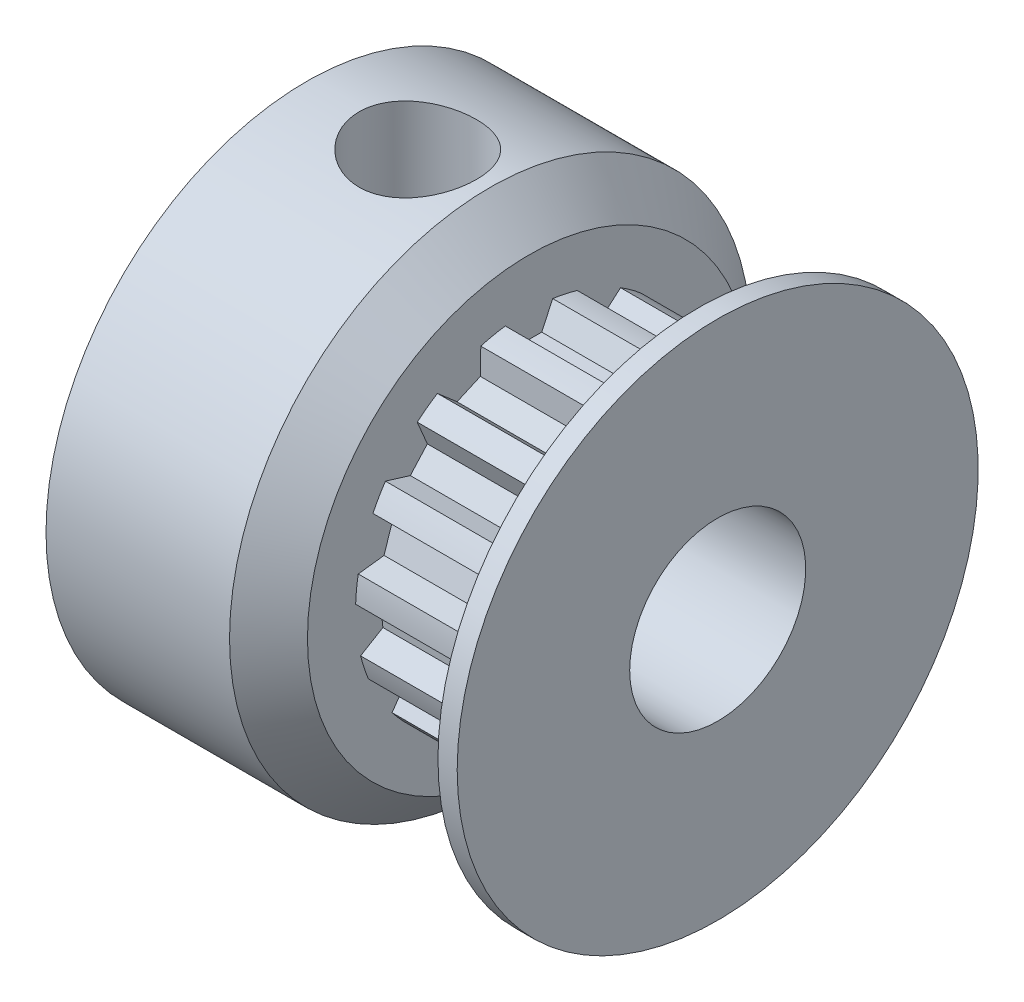
from build123d import *

# Parameters (mm, degrees)
SKETCH4_R          = 4.8514
SKETCH4_R_2        = 4.69265
CUT_EXTRUDE2_DEPTH = 4.064
CUT_EXTRUDE1_DEPTH = 4.064
CIRPATTERN1_COUNT  = 15
SKETCH6_R          = 1.5875
CUT_EXTRUDE3_DEPTH = 12.415131329


with BuildPart() as part:
    # Sketch1 → Revolve1 (revolve)
    with BuildSketch(Plane.XY, mode=Mode.PRIVATE) as revolve1_sk:
        with BuildLine():
            Line((-5.5626, 2.38125), (5.5626, 2.38125))
            Line((5.5626, 2.38125), (5.5626, 7.0485))
            Line((5.5626, 7.0485), (5.0419, 7.0485))
            ThreePointArc((5.0419, 7.0485), (4.654552953, 6.276378742), (4.5212, 5.4229))
            Line((4.5212, 5.4229), (4.5212, 4.8514))
            Line((4.5212, 4.8514), (0.4572, 4.8514))
            Line((0.4572, 4.8514), (0.4572, 5.9944))
            Line((0.4572, 5.9944), (-0.5969, 7.0485))
            Line((-0.5969, 7.0485), (-5.5626, 7.0485))
            Line((-5.5626, 7.0485), (-5.5626, 2.38125))
        make_face()
    revolve(revolve1_sk.sketch.rotate(Axis((-5.5626, 0, 0), (1, 0, 0)), 90), axis=Axis((-5.5626, 0, 0), (1, 0, 0)))

    # Sketch4 → Cut-Extrude2 (cut)
    with BuildSketch(Plane(origin=(0.4572, 0, 0), x_dir=(0, 0, -1), z_dir=(1, 0, 0))):
        Circle(SKETCH4_R)
        Circle(SKETCH4_R_2, mode=Mode.SUBTRACT)
    extrude(amount=CUT_EXTRUDE2_DEPTH, mode=Mode.SUBTRACT)

    # Sketch3 → Cut-Extrude1 (cut)
    with BuildSketch(Plane(origin=(0.4572, 0, 0), x_dir=(0, 0, -1), z_dir=(1, 0, 0))):
        with BuildLine():
            Line((-0.641825655, 4.648550726), (-0.344589457, 4.011125642))
            Line((-0.344589457, 4.011125642), (0.344589457, 4.011125642))
            Line((0.344589457, 4.011125642), (0.641825655, 4.648550726))
            ThreePointArc((0.641825655, 4.648550726), (0, 4.69265), (-0.641825655, 4.648550726))
        make_face()
    cut_extrude1 = extrude(amount=CUT_EXTRUDE1_DEPTH, mode=Mode.SUBTRACT)

    # CirPattern1: Cut-Extrude1 ×15 about axis
    cirpattern1_axis = Axis((0, 0, 0), (1, 0, 0))
    for i in range(1, CIRPATTERN1_COUNT):
        add(cut_extrude1.rotate(cirpattern1_axis, i * 360 / CIRPATTERN1_COUNT), mode=Mode.SUBTRACT)

    # Sketch6 → Cut-Extrude3 (cut, through all)
    with BuildSketch(Plane(origin=(0, 0, 0), x_dir=(1, 0, 0), z_dir=(0, 1, 0))):
        with Locations(Location((-2.5527, 0, 0), (0, 0, 90))):
            Circle(SKETCH6_R)
    extrude(amount=CUT_EXTRUDE3_DEPTH, mode=Mode.SUBTRACT)


solid = part.part
